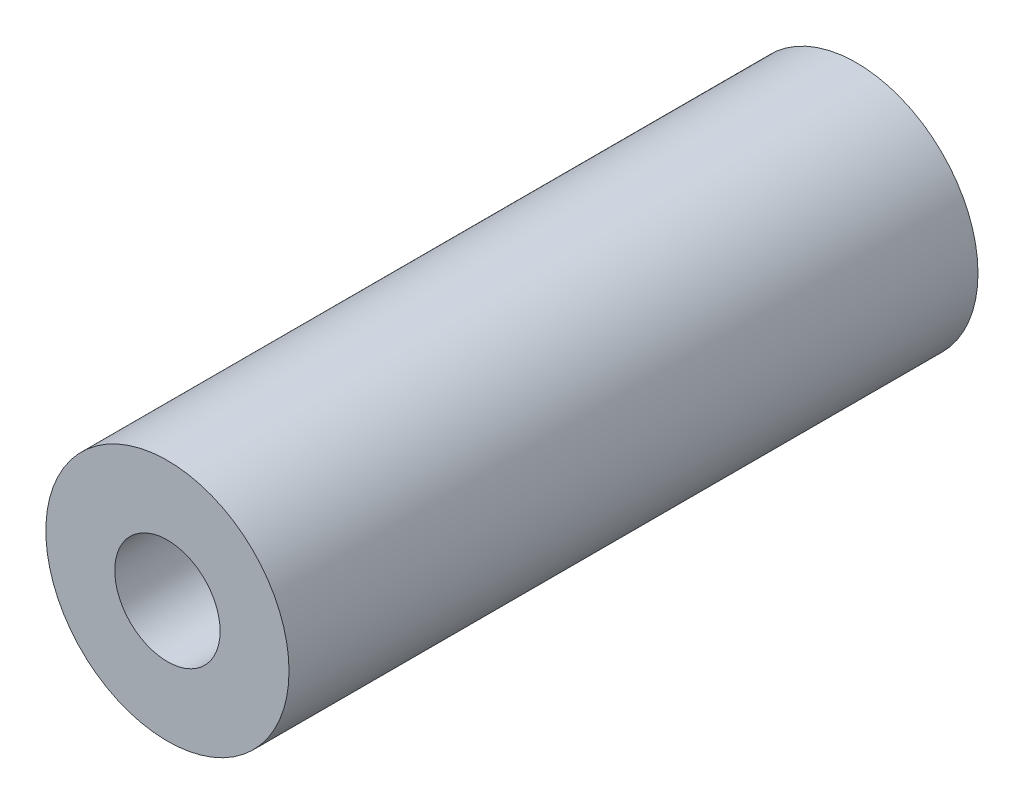
from build123d import *

# Parameters (mm, degrees)
SKETCH_1_R      = 3
SKETCH_1_R_2    = 1.3
EXTRUDE_1_DEPTH = 17


with BuildPart() as part:
    # ｽｹｯﾁ1 → ﾎﾞｽ - 押し出し1 (new body)
    with BuildSketch(Plane.XY):
        Circle(SKETCH_1_R)
        Circle(SKETCH_1_R_2, mode=Mode.SUBTRACT)
    extrude(amount=EXTRUDE_1_DEPTH)


solid = part.part
